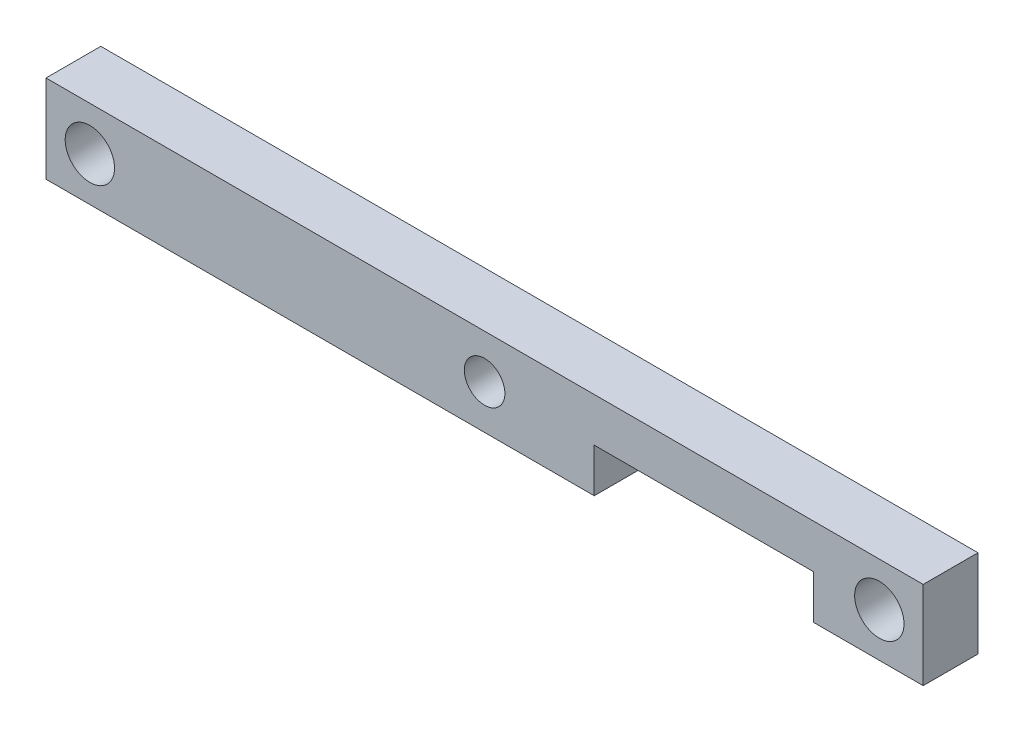
from build123d import *

# Parameters (mm, degrees)
SCHIZZO1_W                   = 80
SCHIZZO1_H                   = 8
SCHIZZO1_R                   = 2.25
SCHIZZO1_R_2                 = 1.85
ESTRUSIONE_ESTRUSIONE1_DEPTH = 5
SCHIZZO2_W                   = 20
SCHIZZO2_H                   = 4
TAGLIO_ESTRUSIONE1_DEPTH     = 8


with BuildPart() as part:
    # Schizzo1 → Estrusione-Estrusione1 (new body)
    with BuildSketch(Plane.XY):
        Rectangle(SCHIZZO1_W, SCHIZZO1_H)
        with Locations((-36, 0)):
            Circle(SCHIZZO1_R, mode=Mode.SUBTRACT)
        Circle(SCHIZZO1_R_2, mode=Mode.SUBTRACT)
        with Locations((36, 0)):
            Circle(SCHIZZO1_R, mode=Mode.SUBTRACT)
    extrude(amount=ESTRUSIONE_ESTRUSIONE1_DEPTH)

    # Schizzo2 → Taglio-Estrusione1 (cut)
    with BuildSketch(Plane.XY.offset(5)):
        with Locations((20, -2)):
            Rectangle(SCHIZZO2_W, SCHIZZO2_H)
    extrude(amount=-TAGLIO_ESTRUSIONE1_DEPTH, mode=Mode.SUBTRACT)


solid = part.part
